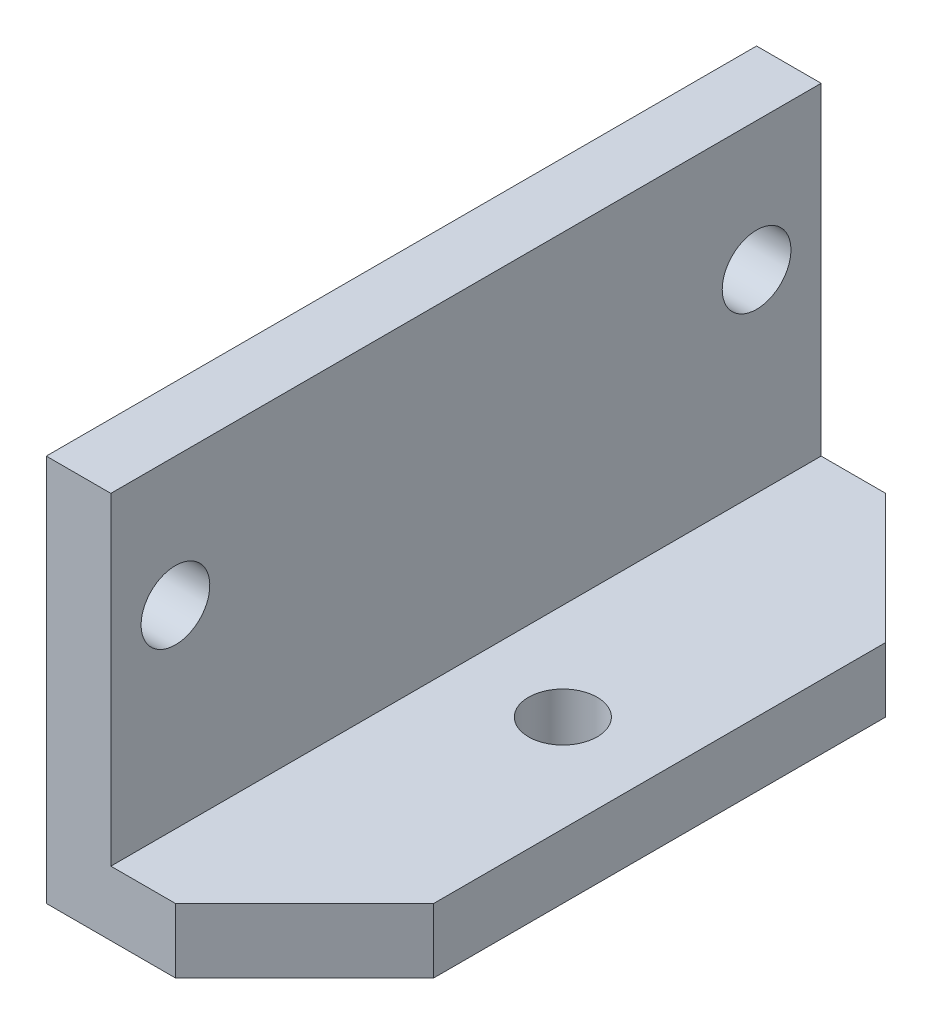
from build123d import *

# Parameters (mm, degrees)
BOSS_EXTRUDE1_DEPTH     = 34.925
F_1_4_CLEARANCE_HOLE1_D = 6.7564
F_1_4_CLEARANCE_HOLE2_D = 6.7564
CHAMFER1_SIZE           = 12.7


with BuildPart() as part:
    # Sketch1 → Boss-Extrude1 (new, symmetric)
    with BuildSketch(Plane.XY):
        Polygon((0, 38.1), (0, 0), (25.4, 0), (25.4, 6.35), (6.35, 6.35), (6.35, 38.1), align=None)
    extrude(amount=BOSS_EXTRUDE1_DEPTH, both=True)

    # 1/4 Clearance Hole1 (through all)
    with Locations(Plane.ZY):
        with Locations((-28.575, 25.4), (28.575, 25.4)):
            Hole(F_1_4_CLEARANCE_HOLE1_D / 2)

    # 1/4 Clearance Hole2 (through all)
    with Locations(Plane(origin=(0, 6.35, 0), x_dir=(1, 0, 0), z_dir=(0, 1, 0))):
        with Locations((15.875, 0)):
            Hole(F_1_4_CLEARANCE_HOLE2_D / 2)

    # Chamfer1
    chamfer1_edges = [part.edges().sort_by_distance(p)[0] for p in [
        (25.4, 3.175, 34.925),
        (25.4, 3.175, -34.925),
    ]]
    chamfer(chamfer1_edges, length=CHAMFER1_SIZE)


solid = part.part
